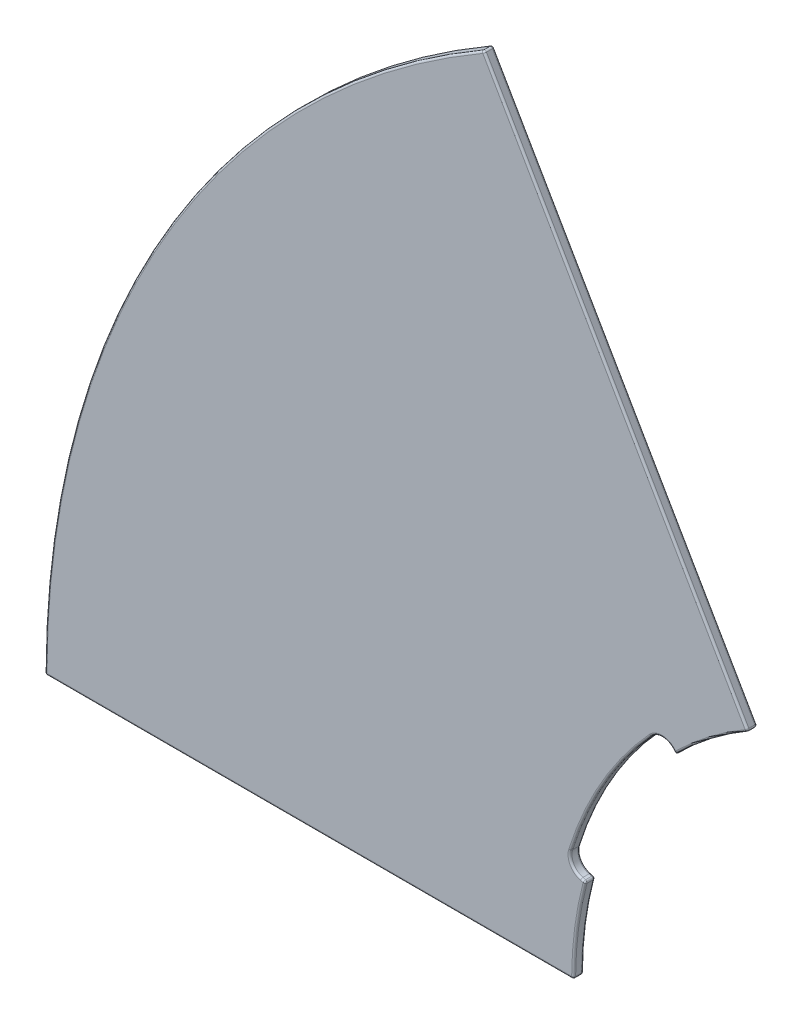
from build123d import *

# Parameters (mm, degrees)
BOSS_EXTRUDE1_DEPTH = 10
FILLET2_R           = 2
SKETCH2_R           = 3.3
CUT_EXTRUDE1_DEPTH  = 5


with BuildPart() as part:
    # Sketch1 → Boss-Extrude1 (new body)
    with BuildSketch(Plane.XY):
        with BuildLine():
            Line((-885.1, 0), (-351.6, 0))
            ThreePointArc((-351.6, 0), (-348.592013259, 45.893009185), (-339.619520523, 91.000776258))
            Line((-339.619520523, 91.000776258), (-344.144284915, 92.213183223))
            ThreePointArc((-344.144284915, 92.213183223), (-353.407280278, 99.477004084), (-354.574758601, 111.190379813))
            ThreePointArc((-354.574758601, 111.190379813), (-321.815040046, 185.8), (-273.581072875, 251.475558583))
            ThreePointArc((-273.581072875, 251.475558583), (-262.853252768, 256.321180561), (-251.931101693, 251.931101693))
            Line((-251.931101693, 251.931101693), (-248.618744265, 248.618744265))
            ThreePointArc((-248.618744265, 248.618744265), (-214.040518439, 278.943034446), (-175.8, 304.494531971))
            Line((-175.8, 304.494531971), (-442.55, 766.51908489))
            ThreePointArc((-442.55, 766.51908489), (-766.51908489, 442.55), (-885.1, 0))
        make_face()
    extrude(amount=BOSS_EXTRUDE1_DEPTH)

    # Fillet2
    fillet2_edges = [part.edges().sort_by_distance(p)[0] for p in [
        (-618.35, 0, 0),
        (-348.592013259, 45.893009185, 0),
        (-341.881902719, 91.60697974, 0),
        (-353.407280278, 99.477004084, 0),
        (-321.815040046, 185.8, 0),
        (-262.853252768, 256.321180561, 0),
        (-250.274922979, 250.274922979, 0),
        (-214.040518439, 278.943034446, 10),
        (-214.040518439, 278.943034446, 0),
        (-309.175, 535.50680843, 0),
        (-766.51908489, 442.55, 0),
        (-250.274922979, 250.274922979, 10),
        (-885.1, 0, 5),
        (-351.6, 0, 5),
        (-339.619520523, 91.000776258, 5),
        (-175.8, 304.494531971, 5),
        (-442.55, 766.51908489, 5),
        (-262.853252768, 256.321180561, 10),
        (-321.815040046, 185.8, 10),
        (-353.407280278, 99.477004084, 10),
        (-341.881902719, 91.60697974, 10),
        (-348.592013259, 45.893009185, 10),
        (-618.35, 0, 10),
        (-766.51908489, 442.55, 10),
        (-309.175, 535.50680843, 10),
    ]]
    fillet(fillet2_edges, radius=FILLET2_R)

    # Sketch2 → Cut-Extrude1 (cut)
    with BuildSketch(Plane(origin=(0, 0, 0), x_dir=(-1, 0, 0), z_dir=(0, 0, -1))):
        with Locations((746.461716535, 448.290381057)):
            Circle(SKETCH2_R)
        with Locations((761.461716535, 422.309618943)):
            Circle(SKETCH2_R)
    extrude(amount=-CUT_EXTRUDE1_DEPTH, mode=Mode.SUBTRACT)


solid = part.part
